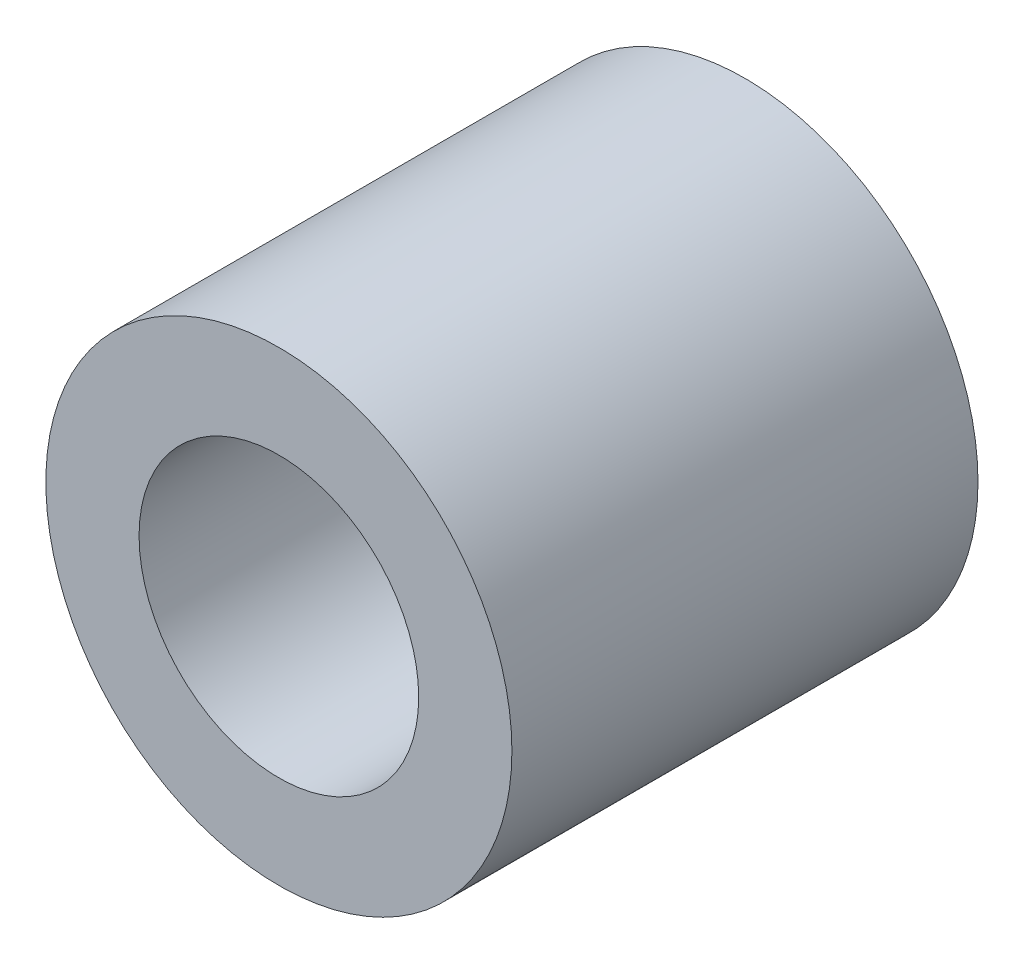
from build123d import *

# Parameters (mm, degrees)
SKETCH2_R           = 5
BOSS_EXTRUDE1_DEPTH = 10
SKETCH3_R           = 3
CUT_EXTRUDE1_DEPTH  = 10


with BuildPart() as part:
    # Sketch2 → Boss-Extrude1 (new body)
    with BuildSketch(Plane.XY):
        Circle(SKETCH2_R)
    extrude(amount=BOSS_EXTRUDE1_DEPTH)

    # Sketch3 → Cut-Extrude1 (cut)
    with BuildSketch(Plane(origin=(0, 0, 0), x_dir=(-1, 0, 0), z_dir=(0, 0, -1))):
        Circle(SKETCH3_R)
    extrude(amount=-CUT_EXTRUDE1_DEPTH, mode=Mode.SUBTRACT)


solid = part.part
